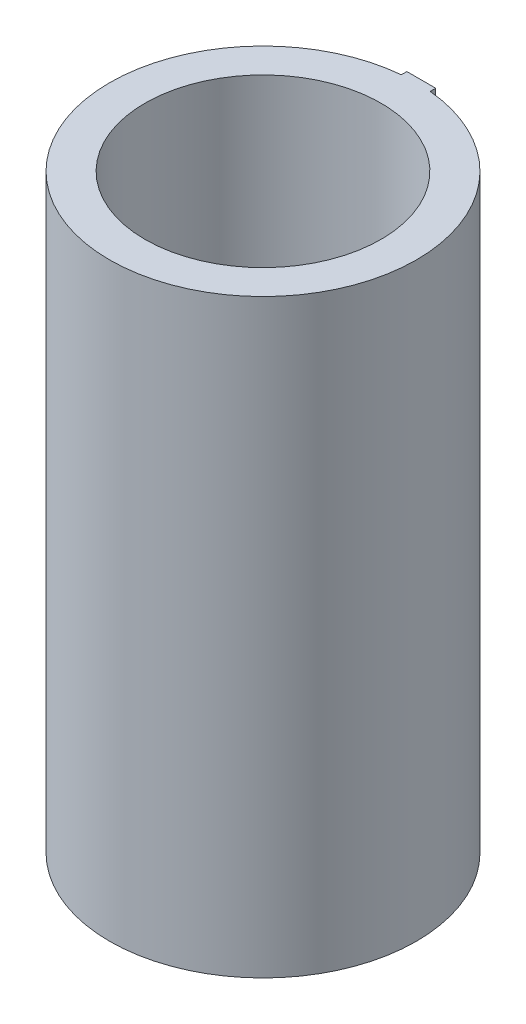
from build123d import *

# Parameters (mm, degrees)
CROQUIS1_R              = 13
CROQUIS1_R_2            = 10
SALIENTE_EXTRUIR1_DEPTH = 50
CROQUIS2_W              = 2.444322312
CROQUIS2_H              = 0.823480184
SALIENTE_EXTRUIR2_DEPTH = 50


with BuildPart() as part:
    # Croquis1 → Saliente-Extruir1 (new body)
    with BuildSketch(Plane(origin=(0, 0, 0), x_dir=(1, 0, 0), z_dir=(0, 1, 0))):
        with Locations(Location((0, 0, 0), (0, 0, 270))):
            Circle(CROQUIS1_R)
        with Locations(Location((0, 0, 0), (0, 0, 270))):
            Circle(CROQUIS1_R_2, mode=Mode.SUBTRACT)
    extrude(amount=SALIENTE_EXTRUIR1_DEPTH)

    # Croquis2 → Saliente-Extruir2 (add)
    with BuildSketch(Plane(origin=(0, 50, 0), x_dir=(1, 0, 0), z_dir=(0, 1, 0))):
        with Locations((0, 13)):
            Rectangle(CROQUIS2_W, CROQUIS2_H)
    extrude(amount=-SALIENTE_EXTRUIR2_DEPTH)


solid = part.part
